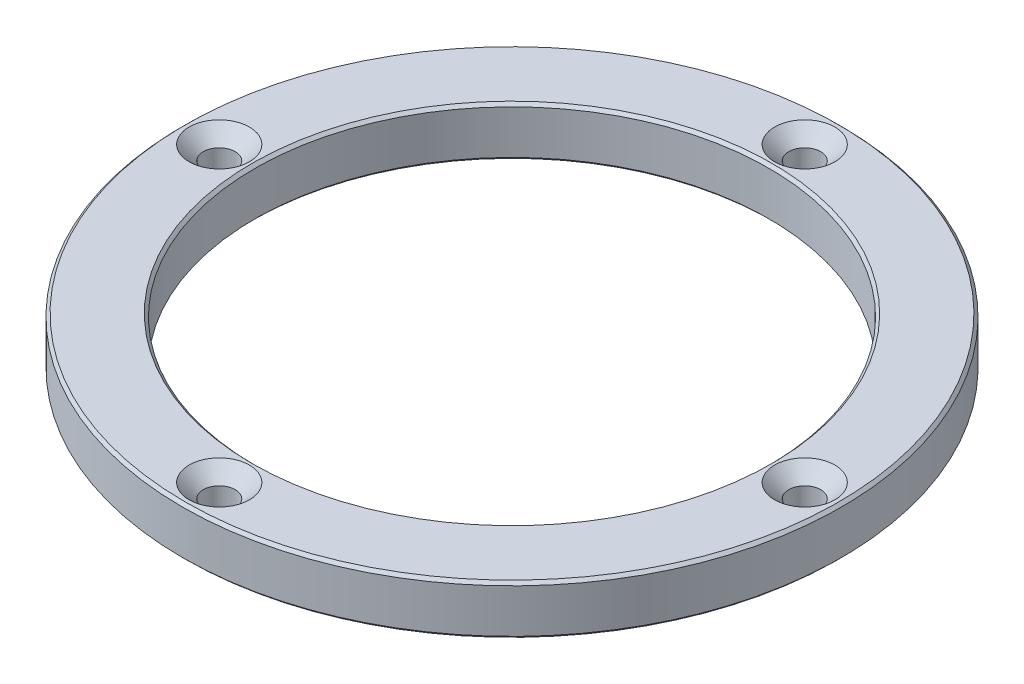
from build123d import *

# Parameters (mm, degrees)
SKETCH_1_R               = 56.85
SKETCH_1_R_2             = 44.35
EXTRUDE_1_DEPTH          = 4.275
CHAMFER_1_SIZE           = 0.5
SKETCH_2_R               = 2.5
CUT_EXTRUDE_1_DEPTH      = 10
PATTERN_CIRCULAR_1_COUNT = 4


with BuildPart() as part:
    # ｽｹｯﾁ1 → ﾎﾞｽ - 押し出し1 (new, symmetric)
    with BuildSketch(Plane(origin=(0, 0, 0), x_dir=(1, 0, 0), z_dir=(0, 1, 0))):
        with Locations(Location((0, 0, 0), (0, 0, 270))):
            Circle(SKETCH_1_R)
        with Locations(Location((0, 0, 0), (0, 0, 270))):
            Circle(SKETCH_1_R_2, mode=Mode.SUBTRACT)
    extrude(amount=EXTRUDE_1_DEPTH, both=True)

    # 面取り1
    chamfer_1_edges = [part.edges().sort_by_distance(p)[0] for p in [
        (0, -4.275, -56.85),
        (0, 4.275, -56.85),
        (0, -4.275, -44.35),
        (0, 4.275, -44.35),
    ]]
    chamfer(chamfer_1_edges, length=CHAMFER_1_SIZE)

    # ｽｹｯﾁ2 → ｶｯﾄ - 押し出し1 (cut)
    with BuildSketch(Plane(origin=(0, 4.275, 0), x_dir=(1, 0, 0), z_dir=(0, 1, 0))):
        with Locations(Location((0, 50.5, 0), (0, 0, 270))):
            Circle(SKETCH_2_R)
    extrude(amount=-CUT_EXTRUDE_1_DEPTH, mode=Mode.SUBTRACT)

    # ｽｹｯﾁ3 → M5 丸皿ねじ用皿穴1 (revolve, cut)
    with BuildSketch(Plane(origin=(0, 4.275, -50.5), x_dir=(0, 0, 1), z_dir=(1, 0, 0))):
        Polygon((0, 0), (0, 11.652366702), (2.75, 10), (2.75, 2.45), (5.2, 0), align=None)
    hole_wizard_m5_1 = revolve(axis=Axis((0, 10.625, -50.5), (0, -1, 0)), mode=Mode.SUBTRACT)

    # 円形ﾊﾟﾀｰﾝ1: M5 丸皿ねじ用皿穴1 ×4 about axis
    pattern_circular_1_axis = Axis((0, 0, 0), (0, 1, 0))
    for i in range(1, PATTERN_CIRCULAR_1_COUNT):
        add(hole_wizard_m5_1.rotate(pattern_circular_1_axis, i * 360 / PATTERN_CIRCULAR_1_COUNT), mode=Mode.SUBTRACT)


solid = part.part
